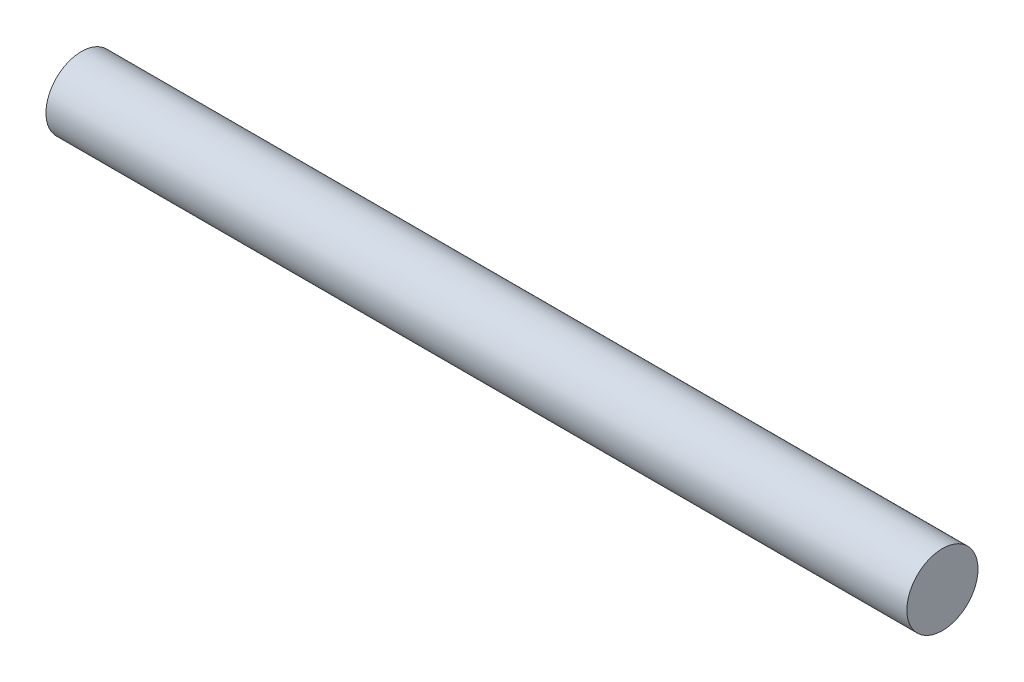
from build123d import *

# Parameters (mm, degrees)
SKETCH_1_R      = 3
EXTRUDE_1_DEPTH = 72.63


with BuildPart() as part:
    # 草图1 → 凸台-拉伸1 (new body)
    with BuildSketch(Plane(origin=(0, 0, 0), x_dir=(0, 0, -1), z_dir=(1, 0, 0))):
        Circle(SKETCH_1_R)
    extrude(amount=EXTRUDE_1_DEPTH)


solid = part.part
